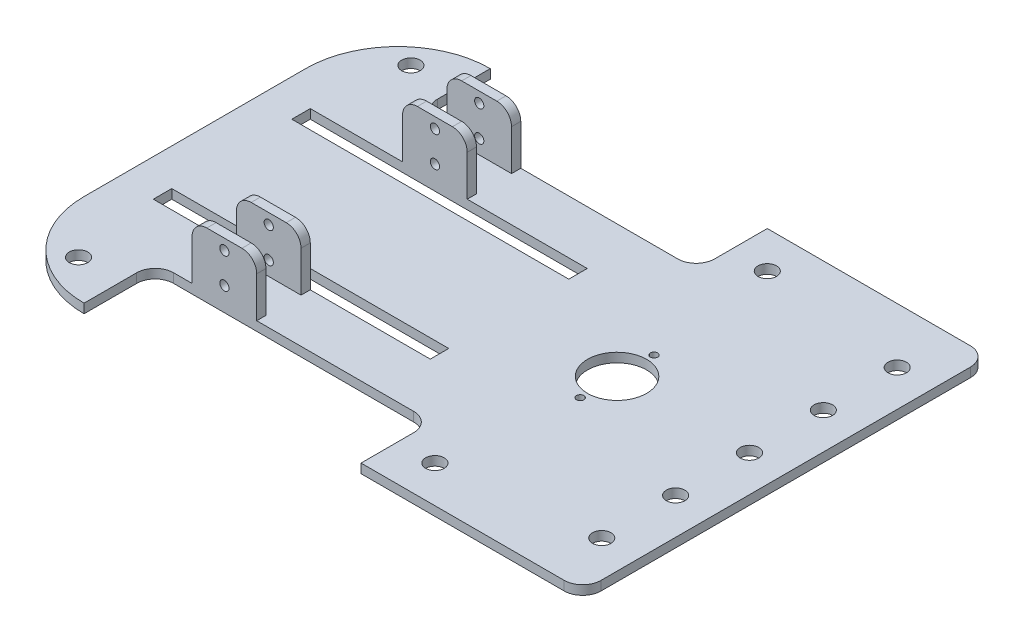
from build123d import *

# Parameters (mm, degrees)
SKETCH1_W           = 320
SKETCH1_H           = 220
BOSS_EXTRUDE1_DEPTH = 2.5
SKETCH2_R           = 5
CUT_EXTRUDE1_DEPTH  = 2.5
FILLET5_R           = 50
SKETCH3_W           = 150
SKETCH3_H           = 38.497712582
CUT_EXTRUDE2_DEPTH  = 2.5
FILLET3_R           = 10
SKETCH4_R           = 16
SKETCH4_R_2         = 2
CUT_EXTRUDE3_DEPTH  = 2.5
SKETCH6_R           = 5
CUT_EXTRUDE4_DEPTH  = 2.5
LPATTERN1_COUNT     = 3
LPATTERN1_PITCH     = 40
LPATTERN2_COUNT     = 3
LPATTERN2_PITCH     = 40
SKETCH8_W           = 35
SKETCH8_H           = 5
BOSS_EXTRUDE2_DEPTH = 30
CUT_EXTRUDE5_START  = -143.004575
SKETCH9_R           = 2.5
CUT_EXTRUDE5_DEPTH  = 143.004575
FILLET6_R           = 8
SKETCH10_W          = 150
SKETCH10_H          = 10
CUT_EXTRUDE6_DEPTH  = 33.75
FILLET7_R           = 10


with BuildPart() as part:
    # Sketch1 → Boss-Extrude1 (new, symmetric)
    with BuildSketch(Plane(origin=(0, 0, 0), x_dir=(1, 0, 0), z_dir=(0, 1, 0))):
        Rectangle(SKETCH1_W, SKETCH1_H)
    extrude(amount=BOSS_EXTRUDE1_DEPTH, both=True)

    # Sketch2 → Cut-Extrude1 (cut, symmetric)
    with BuildSketch(Plane(origin=(0, 0, 0), x_dir=(1, 0, 0), z_dir=(0, 1, 0))):
        with Locations(Location((-133, 90, 0), (0, 0, 270))):
            Circle(SKETCH2_R)
        with Locations(Location((-133, -90, 0), (0, 0, 270))):
            Circle(SKETCH2_R)
        with Locations(Location((60, 90, 0), (0, 0, 90))):
            Circle(SKETCH2_R)
        with Locations(Location((60, -90, 0), (0, 0, 90))):
            Circle(SKETCH2_R)
    extrude(amount=CUT_EXTRUDE1_DEPTH, both=True, mode=Mode.SUBTRACT)

    # Fillet5
    fillet5_edges = [part.edges().sort_by_distance(p)[0] for p in [
        (-160, 0, 110),
        (-160, 0, -110),
    ]]
    fillet(fillet5_edges, radius=FILLET5_R)

    # Sketch3 → Cut-Extrude2 (cut, symmetric)
    with BuildSketch(Plane(origin=(0, 0, 0), x_dir=(1, 0, 0), z_dir=(0, 1, 0))):
        with Locations((-35, 90.751143709)):
            Rectangle(SKETCH3_W, SKETCH3_H)
        with Locations((-35, -90.751143709)):
            Rectangle(SKETCH3_W, SKETCH3_H)
    extrude(amount=CUT_EXTRUDE2_DEPTH, both=True, mode=Mode.SUBTRACT)

    # Fillet3
    fillet3_edges = [part.edges().sort_by_distance(p)[0] for p in [
        (40, 0, -71.502287418),
        (-110, 0, -71.502287418),
        (-110, 0, 71.502287418),
        (40, 0, 71.502287418),
    ]]
    fillet(fillet3_edges, radius=FILLET3_R)

    # Sketch4 → Cut-Extrude3 (cut, symmetric)
    with BuildSketch(Plane(origin=(0, 0, 0), x_dir=(1, 0, 0), z_dir=(0, 1, 0))):
        with Locations(Location((68.657368821, 0, 0), (0, 0, 270))):
            Circle(SKETCH4_R)
        with Locations(Location((68.657368821, 20, 0), (0, 0, 270))):
            Circle(SKETCH4_R_2)
        with Locations(Location((68.657368821, -20, 0), (0, 0, 270))):
            Circle(SKETCH4_R_2)
    extrude(amount=CUT_EXTRUDE3_DEPTH, both=True, mode=Mode.SUBTRACT)

    # Sketch6 → Cut-Extrude4 (cut, symmetric)
    with BuildSketch(Plane(origin=(0, 0, 0), x_dir=(1, 0, 0), z_dir=(0, 1, 0))):
        with Locations(Location((140.361166029, 0, 0), (0, 0, 270))):
            Circle(SKETCH6_R)
    cut_extrude4 = extrude(amount=CUT_EXTRUDE4_DEPTH, both=True, mode=Mode.SUBTRACT)

    # LPattern1: Cut-Extrude4 ×3
    with Locations(*[(0, 0, -i * LPATTERN1_PITCH) for i in range(1, LPATTERN1_COUNT)]):
        add(cut_extrude4, mode=Mode.SUBTRACT)

    # LPattern2: Cut-Extrude4 ×3
    with Locations(*[(0, 0, i * LPATTERN2_PITCH) for i in range(1, LPATTERN2_COUNT)]):
        add(cut_extrude4, mode=Mode.SUBTRACT)

    # Sketch8 → Boss-Extrude2 (add)
    with BuildSketch(Plane(origin=(0, 2.5, 0), x_dir=(1, 0, 0), z_dir=(0, 1, 0))):
        with Locations((-72.5, -69.002287418)):
            Rectangle(SKETCH8_W, SKETCH8_H)
        with Locations((-72.5, -45.002287418)):
            Rectangle(SKETCH8_W, SKETCH8_H)
        with Locations((-72.5, 45.002287418)):
            Rectangle(SKETCH8_W, SKETCH8_H)
        with Locations((-72.5, 69.002287418)):
            Rectangle(SKETCH8_W, SKETCH8_H)
    extrude(amount=BOSS_EXTRUDE2_DEPTH)

    # Sketch9 → Cut-Extrude5 (cut)
    with BuildSketch(Plane.XY.offset(71.502287418).offset(CUT_EXTRUDE5_START)):
        with Locations((-72.5, 26.744818561)):
            Circle(SKETCH9_R)
        with Locations((-72.5, 10.250757787)):
            Circle(SKETCH9_R)
    extrude(amount=CUT_EXTRUDE5_DEPTH, mode=Mode.SUBTRACT)

    # Fillet6
    fillet6_edges = [part.edges().sort_by_distance(p)[0] for p in [
        (-90, 32.5, 69.002287418),
        (-55, 32.5, 69.002287418),
        (-90, 32.5, 45.002287418),
        (-55, 32.5, 45.002287418),
        (-90, 32.5, -45.002287418),
        (-55, 32.5, -45.002287418),
        (-90, 32.5, -69.002287418),
        (-55, 32.5, -69.002287418),
    ]]
    fillet(fillet6_edges, radius=FILLET6_R)

    # Sketch10 → Cut-Extrude6 (cut, symmetric)
    with BuildSketch(Plane(origin=(0, 0, 0), x_dir=(1, 0, 0), z_dir=(0, 1, 0))):
        with Locations((-65, -37.502287418)):
            Rectangle(SKETCH10_W, SKETCH10_H)
        with Locations((-65, 37.502287418)):
            Rectangle(SKETCH10_W, SKETCH10_H)
    extrude(amount=CUT_EXTRUDE6_DEPTH, both=True, mode=Mode.SUBTRACT)

    # Fillet7
    fillet7_edges = [part.edges().sort_by_distance(p)[0] for p in [
        (160, 0, 110),
        (160, 0, -110),
    ]]
    fillet(fillet7_edges, radius=FILLET7_R)


solid = part.part
